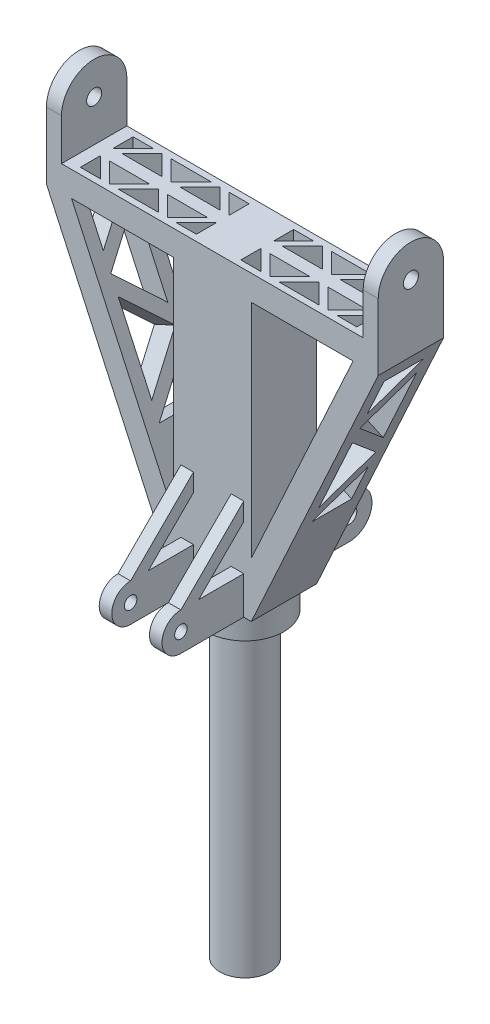
from build123d import *

# Parameters (mm, degrees)
TYKKELSE_LEDDFESTER_OG_BREDDE_H_YDE_SELV_DEPTH = 13
SKETCH28_R                                     = 15.5
SKETCH28_R_2                                   = 10.5
HULL_TIL_L_RBEN_KARBONFIBERR_R_DEPTH           = 10
SKRUEHULL_LEDDFESTER_DEPTH                     = 167.325734629
SKRUEHULL_LEDDFESTER_DEPTH_BACK                = 167.325734629
SKETCH29_R                                     = 3
SKETCH33_W                                     = 5
SKETCH33_H                                     = 20
BREDDE_OG_AVSTAND_STEMPELENDE_DEPTH            = 60
CUT_EXTRUDE4_DEPTH                             = 148.147035308
SIDEM_NSTER_DEPTH                              = 9.088039
SIDEM_NSTER_2_DEPTH                            = 9.088039
UTVIDET_START                                  = -40
SKETCH44_R                                     = 10.5
UTVIDET_L_RBENHULL_INN_I_SELVE_KROPPEN_DEPTH   = 40
M_NSTER_TOPP_DEPTH                             = 10
STEMPELENDE_AV_ST_RSTE_SYLINDER_DEPTH          = 145.150962536
STEMPELENDE_AV_ST_RSTE_SYLINDER_DEPTH_BACK     = 145.150962536
ROD_ENDE_JUSTERE_LENGDEN_ALTS_FESTE_T_R        = 3
SKETCH39_W                                     = 5
SKETCH39_H                                     = 15
SYLINDERFESTE_SELVE_DEN_LILLE_SYLINDERE_DEPTH  = 48
ST_TTER_ST_RSTE_SYLINDER_1_DEPTH               = 5
ST_TTER_ST_RSTE_SYLINDER_2_DEPTH               = 5
SYLINDERFESTE_LITEN_SYLINDER_DEPTH             = 141.653830378
SYLINDERFESTE_LITEN_SYLINDER_DEPTH_BACK        = 141.653830378
SKETCH48_R                                     = 2.5
BOSS_EXTRUDE11_DEPTH                           = 5
BOSS_EXTRUDE12_DEPTH                           = 5
SKETCH51_R                                     = 10
TIL_ASSEMBLY_SLETT_F_R_PRINTING_DEPTH          = 170


with BuildPart() as part:
    # Sketch27 → Tykkelse leddfester og bredde/høyde selve modellen (new, symmetric)
    with BuildSketch(Plane.XY):
        Polygon((66, -50), (-66, -50), (-66, 100), (-60, 100), (-60, 70), (60, 70), (60, 100), (66, 100), align=None)
    extrude(amount=TYKKELSE_LEDDFESTER_OG_BREDDE_H_YDE_SELV_DEPTH, both=True)

    # Sketch28 → Hull til lårben/karbonfiberrør (add)
    with BuildSketch(Plane.XZ.offset(50)):
        with Locations(Location((0, 0, 0), (0, 0, 57.004114526))):
            Circle(SKETCH28_R)
        with Locations(Location((0, 0, 0), (0, 0, 270))):
            Circle(SKETCH28_R_2, mode=Mode.SUBTRACT)
    extrude(amount=HULL_TIL_L_RBEN_KARBONFIBERR_R_DEPTH)

    # Sketch29 → Skruehull leddfester (cut, two sides: drawn at the far end of the back side and taken through both)
    with BuildSketch(Plane(origin=(66, 0, 0), x_dir=(0, 0, -1), z_dir=(1, 0, 0)).offset(-SKRUEHULL_LEDDFESTER_DEPTH_BACK)):
        with Locations((0, 86.5)):
            Circle(SKETCH29_R)
        with BuildLine():
            Line((-13, 86.5), (-13, 71.5))
            Line((-13, 71.5), (-14, 71.5))
            Line((-14, 71.5), (-14, 101))
            Line((-14, 101), (0, 101))
            Line((0, 101), (14, 101))
            Line((14, 101), (14, 71.5))
            Line((14, 71.5), (13, 71.5))
            Line((13, 71.5), (13, 86.5))
            ThreePointArc((13, 86.5), (0, 99.5), (-13, 86.5))
        make_face()
    extrude(amount=SKRUEHULL_LEDDFESTER_DEPTH + SKRUEHULL_LEDDFESTER_DEPTH_BACK, mode=Mode.SUBTRACT)

    # Sketch33 → Bredde og avstand stempelende (add)
    with BuildSketch(Plane(origin=(0, 0, -13), x_dir=(-1, 0, 0), z_dir=(0, 0, -1))):
        with Locations((-6, -40)):
            Rectangle(SKETCH33_W, SKETCH33_H)
        with Locations((6, -40)):
            Rectangle(SKETCH33_W, SKETCH33_H)
    extrude(amount=BREDDE_OG_AVSTAND_STEMPELENDE_DEPTH)

    # Fasong (mønster på selve kroppen) → Cut-Extrude4 (cut, through all)
    with BuildSketch(Plane.XY.offset(13)):
        Polygon((-66, 60), (-15.5, -50), (-66, -50), align=None)
        Polygon((15.5, -50), (66, -50), (66, 60), align=None)
        Polygon((-56, 60), (-15.5, -28.217821782), (-15.5, 60), align=None)
        Polygon((56, 60), (15.5, 60), (15.5, -28.217821782), align=None)
    extrude(amount=-CUT_EXTRUDE4_DEPTH, mode=Mode.SUBTRACT)

    # Sketch40 → Sidemønster (cut)
    with BuildSketch(Plane(origin=(-31.760550161, -14.580979847, 0), x_dir=(0, 0, 1), z_dir=(-0.9088038689830882, -0.41722359439678147, 0))):
        Polygon((-8, 75.564989369), (8, 75.564989369), (8, 59.564989369), align=None)
        Polygon((-8, 68.493921557), (8, 52.493921557), (-8, 36.493921557), align=None)
        Polygon((8, 13.422853745), (-8, 29.422853745), (8, 45.422853745), align=None)
        Polygon((-8, 22.351785934), (8, 6.351785934), (-8, 6.351785934), align=None)
    extrude(amount=-SIDEM_NSTER_DEPTH, mode=Mode.SUBTRACT)

    # Sketch42 → Sidemønster 2 (cut)
    with BuildSketch(Plane(origin=(31.760550161, -14.580979847, 0), x_dir=(0, 0, -1), z_dir=(0.9088038689830882, -0.41722359439678147, 0))):
        Polygon((8, 75.564989369), (-8, 75.564989369), (-8, 59.564989369), align=None)
        Polygon((8, 68.493921557), (-8, 52.493921557), (8, 36.493921557), align=None)
        Polygon((-8, 45.422853745), (8, 29.422853745), (-8, 13.422853745), align=None)
        Polygon((8, 22.351785934), (-8, 6.351785934), (8, 6.351785934), align=None)
    extrude(amount=-SIDEM_NSTER_2_DEPTH, mode=Mode.SUBTRACT)

    # Sketch44 → Utvidet lårbenhull inn i selve kroppen (cut)
    with BuildSketch(Plane.XZ.offset(50).offset(UTVIDET_START)):
        with Locations(Location((0, 0, 0), (0, 0, 270))):
            Circle(SKETCH44_R)
    extrude(amount=UTVIDET_L_RBENHULL_INN_I_SELVE_KROPPEN_DEPTH, mode=Mode.SUBTRACT)

    # Sketch45 → Mønster topp (cut)
    with BuildSketch(Plane(origin=(0, 70, 0), x_dir=(1, 0, 0), z_dir=(0, 1, 0))):
        Polygon((-39.928932188, 10.5), (-31.928932188, 2.5), (-23.928932188, 10.5), align=None)
        Polygon((-16.857864376, 10.5), (-8.857864376, 2.5), (-8.857864376, 10.5), align=None)
        Polygon((-55, 2.5), (-55, 10.5), (-47, 10.5), align=None)
        Polygon((-43.464466094, 10.5), (-51.464466094, 2.5), (-35.464466094, 2.5), align=None)
        Polygon((-20.393398282, 10.5), (-28.393398282, 2.5), (-12.393398282, 2.5), align=None)
        Polygon((-8.857864376, -2.5), (-8.857864376, -10.5), (-16.857864376, -10.5), align=None)
        Polygon((-20.393398282, -10.5), (-12.393398282, -2.5), (-28.393398282, -2.5), align=None)
        Polygon((-23.928932188, -10.5), (-31.928932188, -2.5), (-39.928932188, -10.5), align=None)
        Polygon((-43.464466094, -10.5), (-35.464466094, -2.5), (-51.464466094, -2.5), align=None)
        Polygon((-55, -10.5), (-47, -10.5), (-55, -2.5), align=None)
        Polygon((8.857864376, 2.5), (8.857864376, 10.5), (16.857864376, 10.5), align=None)
        Polygon((16.857864376, -10.5), (8.857864376, -2.5), (8.857864376, -10.5), align=None)
        Polygon((20.393398282, -10.5), (28.393398282, -2.5), (12.393398282, -2.5), align=None)
        Polygon((20.393398282, 10.5), (12.393398282, 2.5), (28.393398282, 2.5), align=None)
        Polygon((23.928932188, 10.5), (31.928932188, 2.5), (39.928932188, 10.5), align=None)
        Polygon((23.928932188, -10.5), (39.928932188, -10.5), (31.928932188, -2.5), align=None)
        Polygon((43.464466094, -10.5), (51.464466094, -2.5), (35.464466094, -2.5), align=None)
        Polygon((55, -2.5), (55, -10.5), (47, -10.5), align=None)
        Polygon((43.464466094, 10.5), (35.464466094, 2.5), (51.464466094, 2.5), align=None)
        Polygon((55, 10.5), (47, 10.5), (55, 2.5), align=None)
    extrude(amount=-M_NSTER_TOPP_DEPTH, mode=Mode.SUBTRACT)

    # Rod-ende, justere lengden (altså feste til største sylinder) → Stempelende av st_rste sylinder (cut, two sides: drawn at the far end of the back side and taken through both)
    with BuildSketch(Plane(origin=(8.5, 0, 0), x_dir=(0, 0, -1), z_dir=(1, 0, 0)).offset(-STEMPELENDE_AV_ST_RSTE_SYLINDER_DEPTH_BACK)):
        with Locations((33, -40)):
            Circle(ROD_ENDE_JUSTERE_LENGDEN_ALTS_FESTE_T_R)
        with BuildLine():
            Line((43, -51), (74, -51))
            Line((74, -51), (74, -29))
            Line((74, -29), (43, -29))
            Line((43, -29), (13, -29))
            Line((13, -29), (13, -31))
            Line((13, -31), (33, -31))
            ThreePointArc((33, -31), (42, -40), (33, -49))
            Line((33, -49), (13, -49))
            Line((13, -49), (13, -51))
            Line((13, -51), (43, -51))
        make_face()
    extrude(amount=STEMPELENDE_AV_ST_RSTE_SYLINDER_DEPTH + STEMPELENDE_AV_ST_RSTE_SYLINDER_DEPTH_BACK, mode=Mode.SUBTRACT)

    # Sketch39 → Sylinderfeste_ selve den lille sylindere (add)
    with BuildSketch(Plane.XY.offset(13)):
        with Locations((-10, -42.5)):
            Rectangle(SKETCH39_W, SKETCH39_H)
        with Locations((10, -42.5)):
            Rectangle(SKETCH39_W, SKETCH39_H)
    extrude(amount=SYLINDERFESTE_SELVE_DEN_LILLE_SYLINDERE_DEPTH)

    # Sketch46 → Støtter største sylinder 1 (add)
    with BuildSketch(Plane(origin=(8.5, 0, 0), x_dir=(0, 0, -1), z_dir=(1, 0, 0))):
        Polygon((13, -6), (13, -14.003905297), (26.596875763, -31), (33, -31), align=None)
    extrude(amount=-ST_TTER_ST_RSTE_SYLINDER_1_DEPTH)

    # Sketch47 → Støtter største sylinder 2 (add)
    with BuildSketch(Plane.ZY.offset(8.5)):
        Polygon((-33, -31), (-13, -6), (-13, -14.003905297), (-26.596875763, -31), align=None)
    extrude(amount=-ST_TTER_ST_RSTE_SYLINDER_2_DEPTH)

    # Sketch48 → Sylinderfeste, liten sylinder (cut, two sides: drawn at the far end of the back side and taken through both)
    with BuildSketch(Plane.ZY.offset(12.5).offset(-SYLINDERFESTE_LITEN_SYLINDER_DEPTH_BACK)):
        with Locations(Location((38, -42.5, 0), (0, 0, 270))):
            Circle(SKETCH48_R)
        with BuildLine():
            Line((38, -50), (23.179811187, -50))
            Line((23.179811187, -50), (23.179811187, -51))
            Line((23.179811187, -51), (62, -51))
            Line((62, -51), (62, -34))
            Line((62, -34), (13, -34))
            Line((13, -34), (13, -35))
            Line((13, -35), (38, -35))
            ThreePointArc((38, -35), (45.5, -42.5), (38, -50))
        make_face()
    extrude(amount=SYLINDERFESTE_LITEN_SYLINDER_DEPTH + SYLINDERFESTE_LITEN_SYLINDER_DEPTH_BACK, mode=Mode.SUBTRACT)

    # Sketch49 → Boss-Extrude11 (add)
    with BuildSketch(Plane.ZY.offset(12.5)):
        Polygon((38, -35), (13, -10), (13, -17.071067812), (30.928932188, -35), align=None)
    extrude(amount=-BOSS_EXTRUDE11_DEPTH)

    # Sketch50 → Boss-Extrude12 (add)
    with BuildSketch(Plane(origin=(12.5, 0, 0), x_dir=(0, 0, -1), z_dir=(1, 0, 0))):
        Polygon((-38, -35), (-30.928932188, -35), (-13, -17.071067812), (-13, -10), align=None)
    extrude(amount=-BOSS_EXTRUDE12_DEPTH)

    # Sketch51 → TIL ASSEMBLY - SLETT FØR PRINTING (add)
    with BuildSketch(Plane.XZ.offset(10)):
        with Locations(Location((0, 0, 0), (0, 0, 270))):
            Circle(SKETCH51_R)
    extrude(amount=TIL_ASSEMBLY_SLETT_F_R_PRINTING_DEPTH)


solid = part.part
